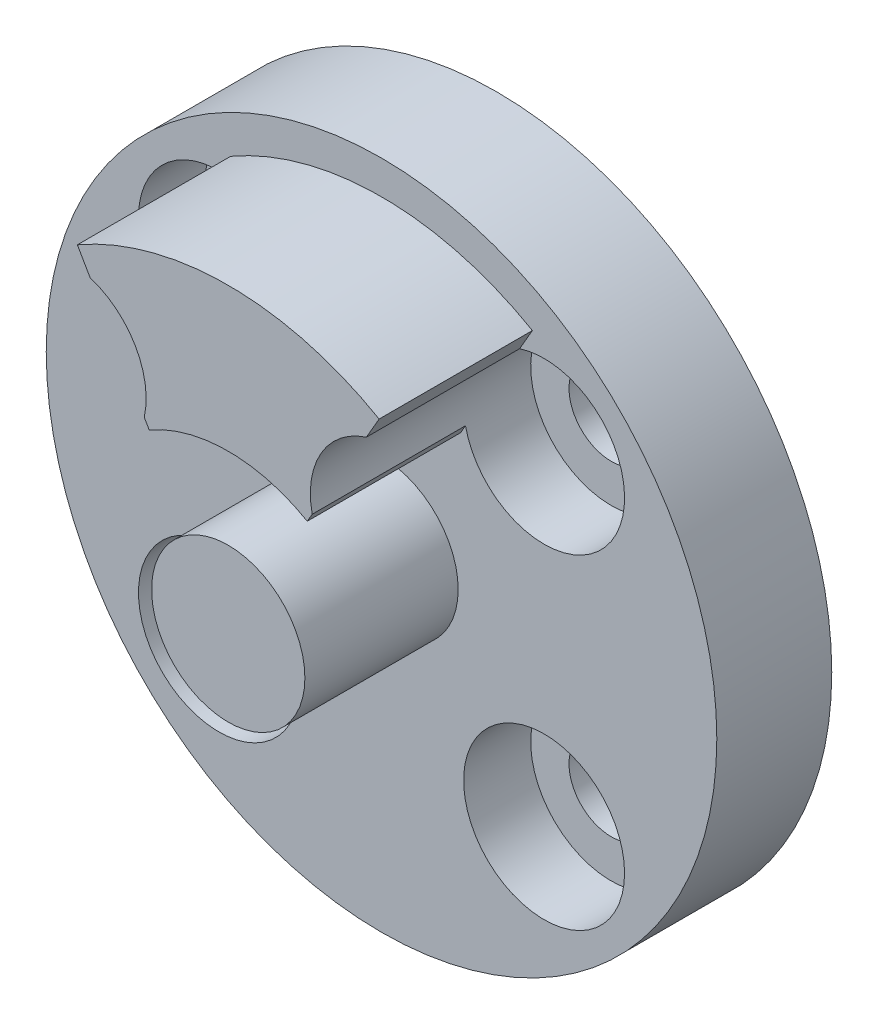
from build123d import *

# Parameters (mm, degrees)
SKETCH1_R                      = 17.5
BOSS_EXTRUDE1_DEPTH            = 3
BOSS_EXTRUDE2_DEPTH            = 8
SKETCH3_R                      = 4
BOSS_EXTRUDE3_DEPTH            = 8
SKETCH4_R                      = 2.2
CUT_EXTRUDE1_DEPTH             = 6
SKETCH5_R                      = 4.2
CUT_EXTRUDE2_DEPTH             = 3.5
CUT_EXTRUDE2_DIRECTION_2_REACH = 28.01


with BuildPart() as part:
    # Sketch1 → Boss-Extrude1 (new, symmetric)
    with BuildSketch(Plane.XY):
        Circle(SKETCH1_R)
    extrude(amount=BOSS_EXTRUDE1_DEPTH, both=True)

    # Sketch2 → Boss-Extrude2 (add)
    with BuildSketch(Plane.XY.offset(3)):
        with BuildLine():
            Line((7.875, 13.63990011), (4.125, 7.144709581))
            ThreePointArc((4.125, 7.144709581), (0, 8.25), (-4.125, 7.144709581))
            Line((-4.125, 7.144709581), (-7.875, 13.63990011))
            ThreePointArc((-7.875, 13.63990011), (0, 15.75), (7.875, 13.63990011))
        make_face()
    extrude(amount=BOSS_EXTRUDE2_DEPTH)

    # Sketch3 → Boss-Extrude3 (add)
    with BuildSketch(Plane.XY.offset(3)):
        Circle(SKETCH3_R)
    extrude(amount=BOSS_EXTRUDE3_DEPTH)

    # Sketch4 → Cut-Extrude1 (cut)
    with BuildSketch(Plane(origin=(0, 0, -3), x_dir=(-1, 0, 0), z_dir=(0, 0, -1))):
        with Locations((-8.485281374, 8.485281374)):
            Circle(SKETCH4_R)
        with Locations((8.485281374, 8.485281374)):
            Circle(SKETCH4_R)
        with Locations((8.485281374, -8.485281374)):
            Circle(SKETCH4_R)
        with Locations((-8.485281374, -8.485281374)):
            Circle(SKETCH4_R)
    extrude(amount=-CUT_EXTRUDE1_DEPTH, mode=Mode.SUBTRACT)

    # Sketch5 → Cut-Extrude2 (cut)
    with BuildSketch(Plane.XY.offset(3)):
        with Locations((-8.485281374, -8.485281374)):
            Circle(SKETCH5_R)
        with Locations(Location((-8.485281374, 8.485281374, 0), (0, 0, 72.312607482))):
            Circle(SKETCH5_R)
        with Locations(Location((8.485281374, 8.485281374, 0), (0, 0, 192.312607482))):
            Circle(SKETCH5_R)
        with Locations((8.485281374, -8.485281374)):
            Circle(SKETCH5_R)
    extrude(amount=-CUT_EXTRUDE2_DEPTH, mode=Mode.SUBTRACT)

    # Cut-Extrude2 direction 2: up to this face of the body (flat: up to its plane)
    cut_extrude2_direction_2_end = Plane(part.part.faces().sort_by_distance((0, 11.8321753, 11))[0])
    # Sketch5 → Cut-Extrude2 direction 2 (cut, up to the picked face)
    with BuildSketch(Plane.XY.offset(3), mode=Mode.PRIVATE) as cut_extrude2_direction_2_sk1:
        with Locations((-8.485281374, -8.485281374)):
            Circle(SKETCH5_R)
    cut_extrude2_direction_2_tool1 = split(extrude(cut_extrude2_direction_2_sk1.sketch, amount=CUT_EXTRUDE2_DIRECTION_2_REACH, mode=Mode.PRIVATE), bisect_by=cut_extrude2_direction_2_end, keep=Keep.BOTH, mode=Mode.PRIVATE)
    # Sketch5 → Cut-Extrude2 direction 2 (cut, up to the picked face)
    with BuildSketch(Plane.XY.offset(3), mode=Mode.PRIVATE) as cut_extrude2_direction_2_sk2:
        with Locations(Location((-8.485281374, 8.485281374, 0), (0, 0, 72.312607482))):
            Circle(SKETCH5_R)
    cut_extrude2_direction_2_tool2 = split(extrude(cut_extrude2_direction_2_sk2.sketch, amount=CUT_EXTRUDE2_DIRECTION_2_REACH, mode=Mode.PRIVATE), bisect_by=cut_extrude2_direction_2_end, keep=Keep.BOTH, mode=Mode.PRIVATE)
    # Sketch5 → Cut-Extrude2 direction 2 (cut, up to the picked face)
    with BuildSketch(Plane.XY.offset(3), mode=Mode.PRIVATE) as cut_extrude2_direction_2_sk3:
        with Locations(Location((8.485281374, 8.485281374, 0), (0, 0, 192.312607482))):
            Circle(SKETCH5_R)
    cut_extrude2_direction_2_tool3 = split(extrude(cut_extrude2_direction_2_sk3.sketch, amount=CUT_EXTRUDE2_DIRECTION_2_REACH, mode=Mode.PRIVATE), bisect_by=cut_extrude2_direction_2_end, keep=Keep.BOTH, mode=Mode.PRIVATE)
    # Sketch5 → Cut-Extrude2 direction 2 (cut, up to the picked face)
    with BuildSketch(Plane.XY.offset(3), mode=Mode.PRIVATE) as cut_extrude2_direction_2_sk4:
        with Locations((8.485281374, -8.485281374)):
            Circle(SKETCH5_R)
    cut_extrude2_direction_2_tool4 = split(extrude(cut_extrude2_direction_2_sk4.sketch, amount=CUT_EXTRUDE2_DIRECTION_2_REACH, mode=Mode.PRIVATE), bisect_by=cut_extrude2_direction_2_end, keep=Keep.BOTH, mode=Mode.PRIVATE)
    add(cut_extrude2_direction_2_tool1.solids().sort_by(Axis((-8.485281, -8.485281, 3), (0, 0, 1)))[0], mode=Mode.SUBTRACT)
    add(cut_extrude2_direction_2_tool2.solids().sort_by(Axis((-8.485281, 8.485281, 3), (0, 0, 1)))[0], mode=Mode.SUBTRACT)
    add(cut_extrude2_direction_2_tool3.solids().sort_by(Axis((8.485281, 8.485281, 3), (0, 0, 1)))[0], mode=Mode.SUBTRACT)
    add(cut_extrude2_direction_2_tool4.solids().sort_by(Axis((8.485281, -8.485281, 3), (0, 0, 1)))[0], mode=Mode.SUBTRACT)


solid = part.part
